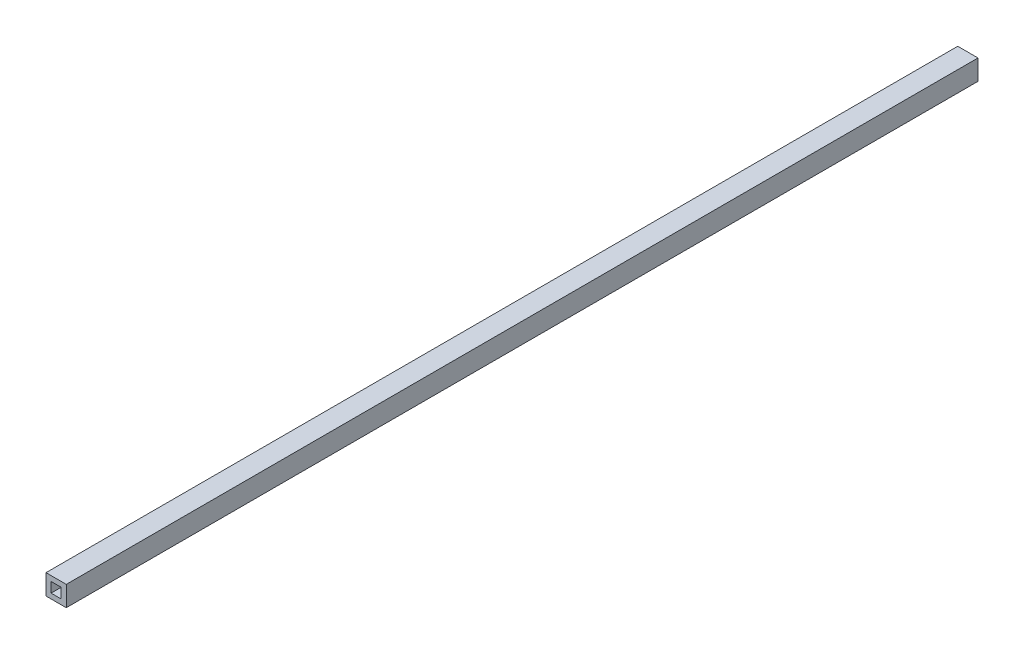
from build123d import *

# Parameters (mm, degrees)
SKETCH1_W           = 20
SKETCH1_H           = 20
SKETCH1_W_2         = 10
SKETCH1_H_2         = 10
EXTRUDE_THIN1_DEPTH = 900


with BuildPart() as part:
    # Sketch1 → Extrude-Thin1 (new body)
    with BuildSketch(Plane.XY):
        Rectangle(SKETCH1_W, SKETCH1_H)
        Rectangle(SKETCH1_W_2, SKETCH1_H_2, mode=Mode.SUBTRACT)
    extrude(amount=EXTRUDE_THIN1_DEPTH)


solid = part.part
